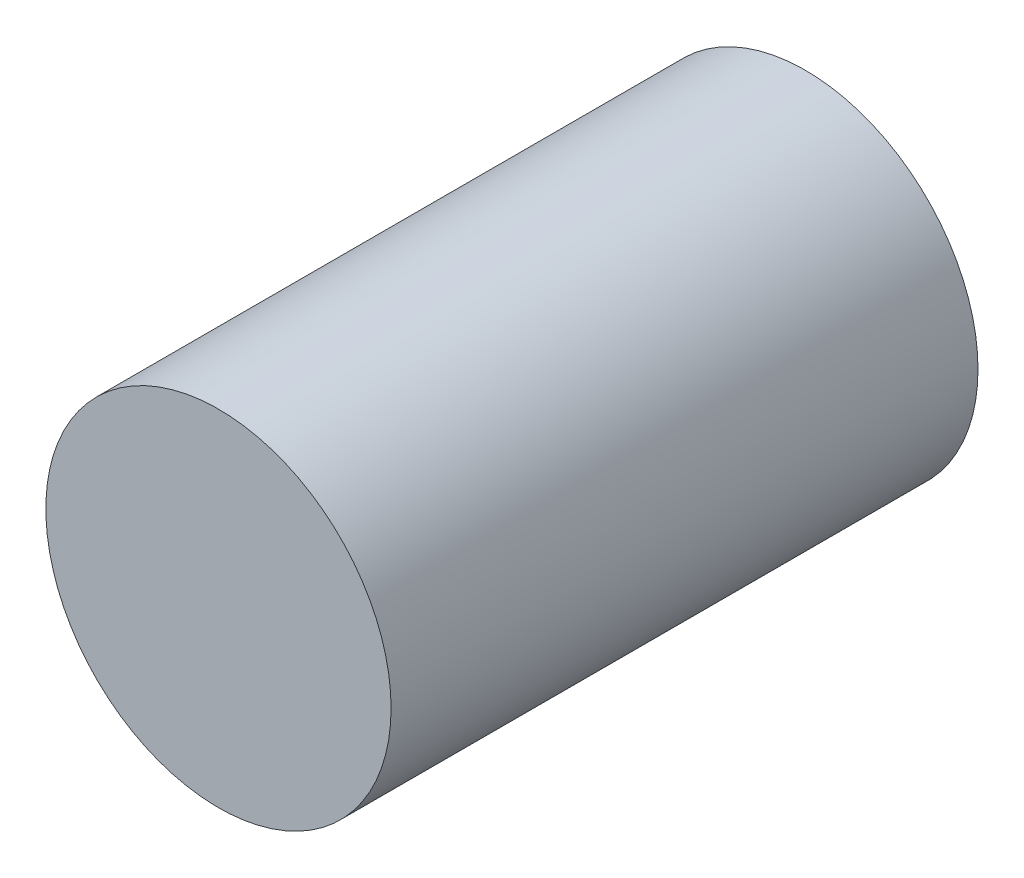
from build123d import *

# Parameters (mm, degrees)
SKETCH1_R           = 2.5
BOSS_EXTRUDE1_DEPTH = 8.5


with BuildPart() as part:
    # Sketch1 → Boss-Extrude1 (new body)
    with BuildSketch(Plane.XY):
        Circle(SKETCH1_R)
    extrude(amount=BOSS_EXTRUDE1_DEPTH)


solid = part.part
